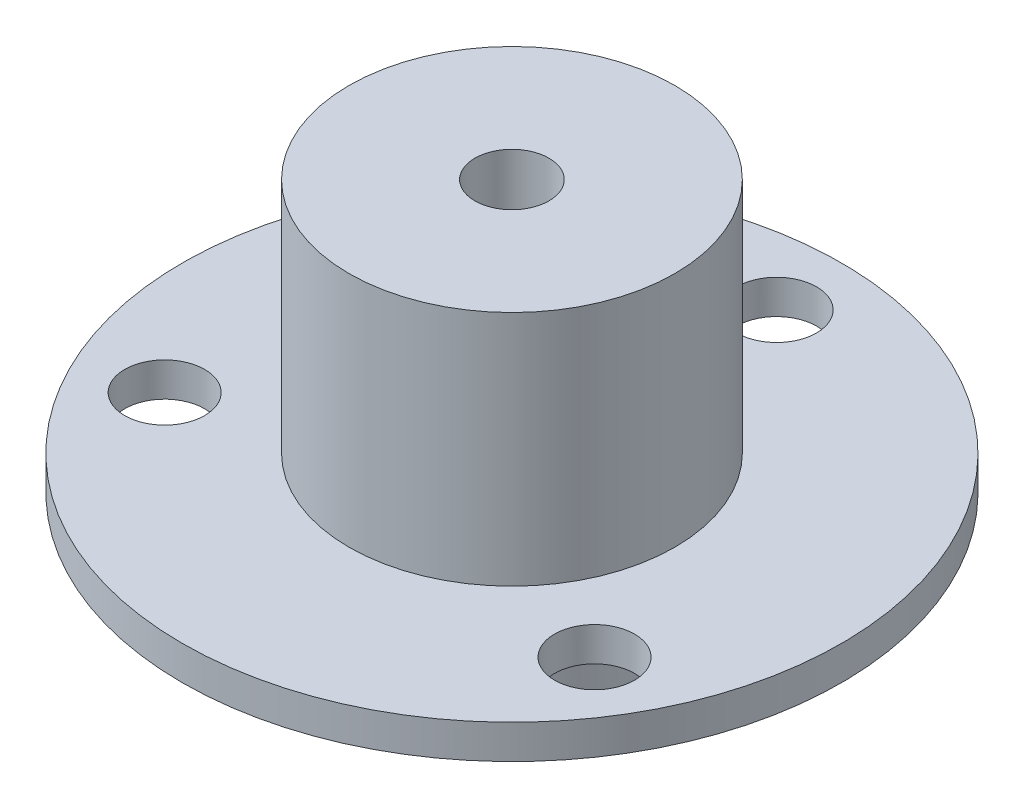
from build123d import *

# Parameters (mm, degrees)
SKETCH1_R           = 11
BOSS_EXTRUDE1_DEPTH = 5
SKETCH2_R           = 22.25
BOSS_EXTRUDE2_DEPTH = 2.3
SKETCH3_R           = 11
BOSS_EXTRUDE3_DEPTH = 16
SKETCH4_R           = 2.5
CUT_EXTRUDE1_DEPTH  = 30
SKETCH5_R           = 2.7
CUT_EXTRUDE2_DEPTH  = 16


with BuildPart() as part:
    # Sketch1 → Boss-Extrude1 (new body)
    with BuildSketch(Plane(origin=(0, 0, 0), x_dir=(1, 0, 0), z_dir=(0, 1, 0))):
        with Locations(Location((0, 0, 0), (0, 0, 270))):
            Circle(SKETCH1_R)
    extrude(amount=BOSS_EXTRUDE1_DEPTH)

    # Sketch2 → Boss-Extrude2 (add)
    with BuildSketch(Plane(origin=(0, 5, 0), x_dir=(1, 0, 0), z_dir=(0, 1, 0))):
        with Locations(Location((0, 0, 0), (0, 0, 270))):
            Circle(SKETCH2_R)
    extrude(amount=BOSS_EXTRUDE2_DEPTH)

    # Sketch3 → Boss-Extrude3 (add)
    with BuildSketch(Plane(origin=(0, 7.3, 0), x_dir=(1, 0, 0), z_dir=(0, 1, 0))):
        with Locations(Location((0, 0, 0), (0, 0, 270))):
            Circle(SKETCH3_R)
    extrude(amount=BOSS_EXTRUDE3_DEPTH)

    # Sketch4 → Cut-Extrude1 (cut)
    with BuildSketch(Plane.XZ):
        with Locations(Location((0, 0, 0), (0, 0, 270))):
            Circle(SKETCH4_R)
    extrude(amount=-CUT_EXTRUDE1_DEPTH, mode=Mode.SUBTRACT)

    # Sketch5 → Cut-Extrude2 (cut)
    with BuildSketch(Plane.XZ.offset(-5)):
        with Locations(Location((-15.270211919, 8.174388537, 0), (0, 0, 270))):
            Circle(SKETCH5_R)
        with Locations(Location((14.714334093, 9.137197175, 0), (0, 0, 270))):
            Circle(SKETCH5_R)
        with Locations(Location((0.555877826, -17.311585711, 0), (0, 0, 270))):
            Circle(SKETCH5_R)
    extrude(amount=-CUT_EXTRUDE2_DEPTH, mode=Mode.SUBTRACT)


solid = part.part
